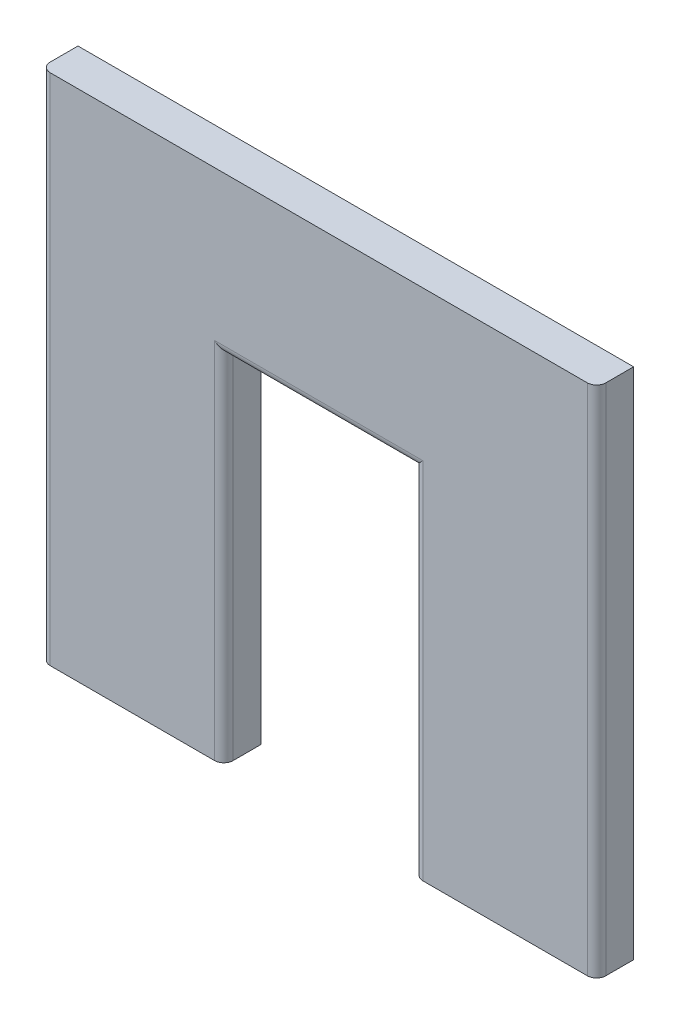
from build123d import *

# Parameters (mm, degrees)
SKETCH1_W           = 30
SKETCH1_H           = 27.727272728
BOSS_EXTRUDE1_DEPTH = 2
SKETCH2_W           = 10.248894408
SKETCH2_H           = 19.156033471
CUT_EXTRUDE1_DEPTH  = 2
FILLET1_R           = 0.5
FILLET2_R           = 0.5
FILLET3_R           = 0.5
FILLET4_R           = 0.5
FILLET5_R           = 0.5


with BuildPart() as part:
    # Sketch1 → Boss-Extrude1 (new body)
    with BuildSketch(Plane.XY):
        Rectangle(SKETCH1_W, SKETCH1_H)
    extrude(amount=BOSS_EXTRUDE1_DEPTH)

    # Sketch2 → Cut-Extrude1 (cut)
    with BuildSketch(Plane.XY.offset(2)):
        with Locations((0, -4.294276099)):
            Rectangle(SKETCH2_W, SKETCH2_H)
    extrude(amount=-CUT_EXTRUDE1_DEPTH, mode=Mode.SUBTRACT)

    # Fillet1
    fillet1_edges = [part.edges().sort_by_distance(p)[0] for p in [
        (-15, 0, 2),
    ]]
    fillet(fillet1_edges, radius=FILLET1_R)

    # Fillet2
    fillet2_edges = [part.edges().sort_by_distance(p)[0] for p in [
        (15, 0, 2),
    ]]
    fillet(fillet2_edges, radius=FILLET2_R)

    # Fillet3
    fillet3_edges = [part.edges().sort_by_distance(p)[0] for p in [
        (-5.124447204, -4.289947863, 2),
    ]]
    fillet(fillet3_edges, radius=FILLET3_R)

    # Fillet4
    fillet4_edges = [part.edges().sort_by_distance(p)[0] for p in [
        (5.124447204, -4.289947863, 2),
    ]]
    fillet(fillet4_edges, radius=FILLET4_R)

    # Fillet5
    fillet5_edges = [part.edges().sort_by_distance(p)[0] for p in [
        (0, 5.283740637, 2),
    ]]
    fillet(fillet5_edges, radius=FILLET5_R)


solid = part.part
